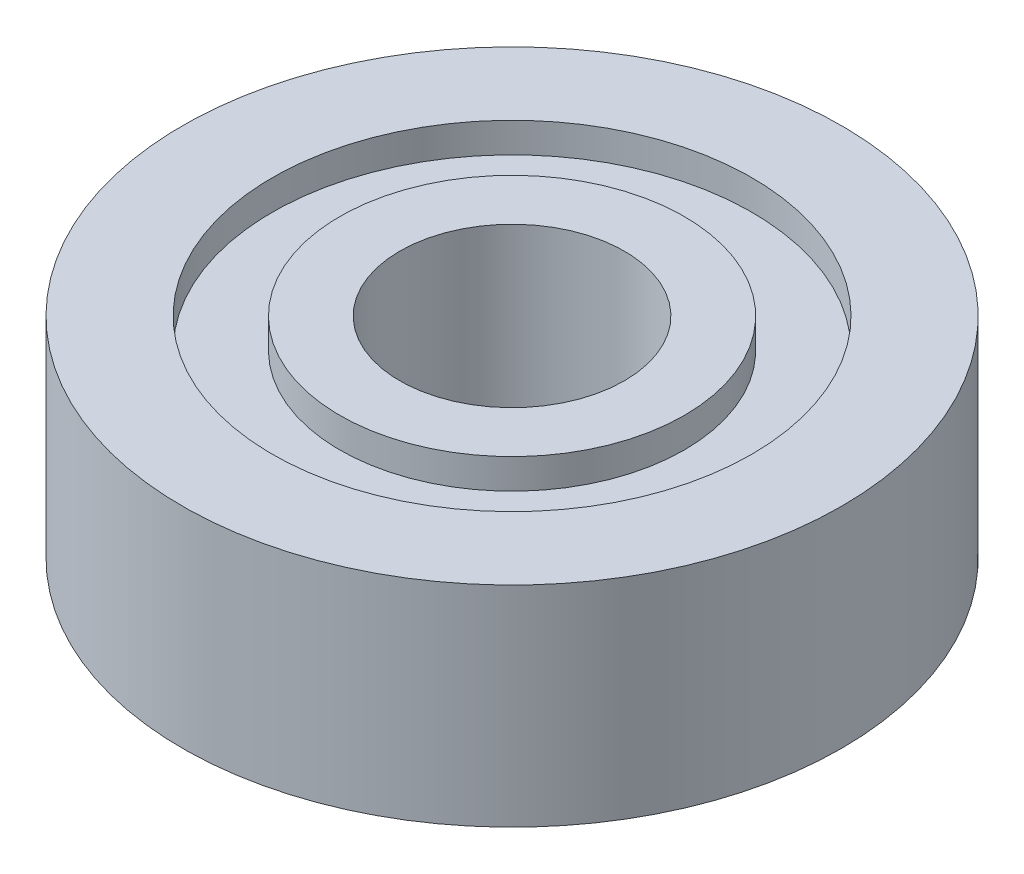
from build123d import *


with BuildPart() as part:
    # Sketch2 → Revolve1 (revolve)
    with BuildSketch(Plane.XY, mode=Mode.PRIVATE) as revolve1_sk:
        Polygon((-3.75, 7), (-3.75, 0), (-5.75, 0), (-5.75, 1), (-8, 1), (-8, 0), (-11, 0), (-11, 7), (-8, 7), (-8, 6), (-5.75, 6), (-5.75, 7), align=None)
    revolve(revolve1_sk.sketch.rotate(Axis((0, 0, 0), (0, 1, 0)), 180), axis=Axis((0, 0, 0), (0, 1, 0)))


solid = part.part
